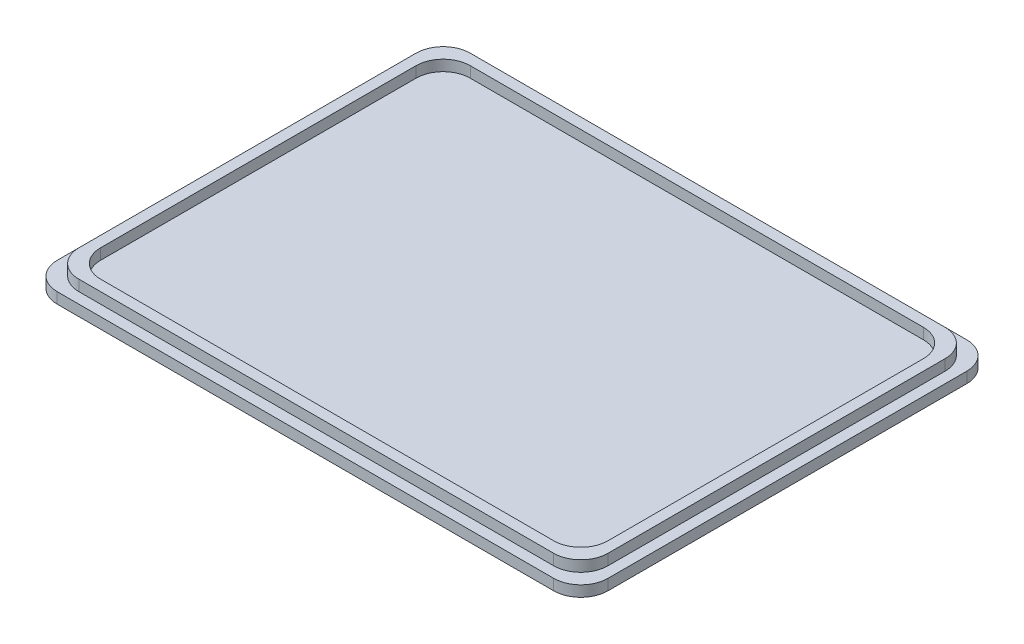
from build123d import *

# Parameters (mm, degrees)
SKETCH1_W           = 101.6
SKETCH1_H           = 76.2
BOSS_EXTRUDE1_DEPTH = 2
SKETCH2_W           = 97.6
SKETCH2_H           = 72.2
SKETCH2_W_2         = 93.6
SKETCH2_H_2         = 68.2
EXTRUDE_THIN1_DEPTH = 2
FILLET1_R           = 5
FILLET2_R           = 5


with BuildPart() as part:
    # Sketch1 → Boss-Extrude1 (new body)
    with BuildSketch(Plane(origin=(0, 0, 0), x_dir=(1, 0, 0), z_dir=(0, 1, 0))):
        Rectangle(SKETCH1_W, SKETCH1_H)
    extrude(amount=BOSS_EXTRUDE1_DEPTH)

    # Sketch2 → Extrude-Thin1 (add)
    with BuildSketch(Plane(origin=(0, 2, 0), x_dir=(1, 0, 0), z_dir=(0, 1, 0))):
        Rectangle(SKETCH2_W, SKETCH2_H)
        Rectangle(SKETCH2_W_2, SKETCH2_H_2, mode=Mode.SUBTRACT)
    extrude(amount=EXTRUDE_THIN1_DEPTH)

    # Fillet1
    fillet1_edges = [part.edges().sort_by_distance(p)[0] for p in [
        (50.8, 1, 38.1),
        (-50.8, 1, 38.1),
        (-50.8, 1, -38.1),
        (50.8, 1, -38.1),
    ]]
    fillet(fillet1_edges, radius=FILLET1_R)

    # Fillet2
    fillet2_edges = [part.edges().sort_by_distance(p)[0] for p in [
        (48.8, 3, -36.1),
        (-48.8, 3, -36.1),
        (-48.8, 3, 36.1),
        (48.8, 3, 36.1),
        (-46.8, 3, -34.1),
        (-46.8, 3, 34.1),
        (46.8, 3, 34.1),
        (46.8, 3, -34.1),
    ]]
    fillet(fillet2_edges, radius=FILLET2_R)


solid = part.part
